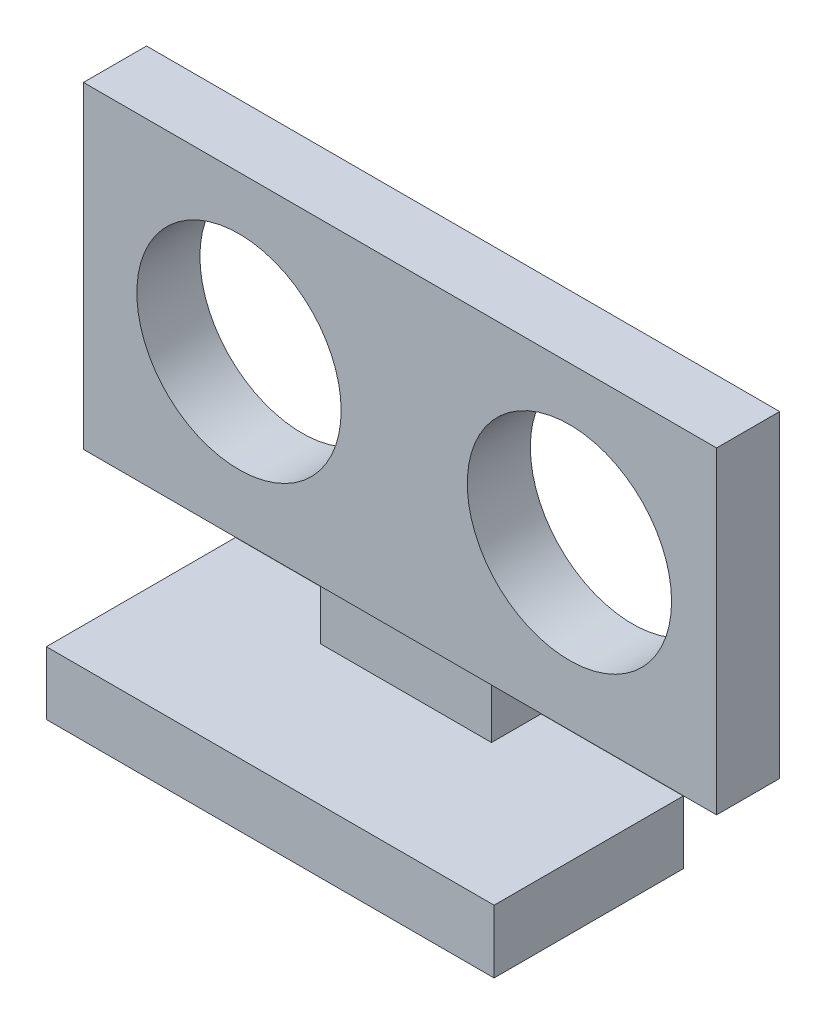
from build123d import *

# Parameters (mm, degrees)
SKETCH1_W           = 35.5
SKETCH1_H           = 15
BOSS_EXTRUDE7_DEPTH = 5
SKETCH5_W           = 13.567085075
SKETCH5_H           = 3.932792286
BOSS_EXTRUDE8_DEPTH = 5
SKETCH6_W           = 50.2
SKETCH6_H           = 5
BOSS_EXTRUDE9_DEPTH = 25.2
SKETCH7_R           = 8.1
CUT_EXTRUDE1_DEPTH  = 10


with BuildPart() as part:
    # Sketch1 → Boss-Extrude7 (new body)
    with BuildSketch(Plane(origin=(0, 0, 0), x_dir=(1, 0, 0), z_dir=(0, 1, 0))):
        with Locations((32.254129859, 13.775388257)):
            Rectangle(SKETCH1_W, SKETCH1_H)
    extrude(amount=BOSS_EXTRUDE7_DEPTH)

    # Sketch5 → Boss-Extrude8 (add)
    with BuildSketch(Plane(origin=(0, 5, 0), x_dir=(1, 0, 0), z_dir=(0, 1, 0))):
        with Locations((31.950040022, 19.308992114)):
            Rectangle(SKETCH5_W, SKETCH5_H)
    extrude(amount=BOSS_EXTRUDE8_DEPTH)

    # Sketch6 → Boss-Extrude9 (add)
    with BuildSketch(Plane(origin=(1.124638213, 10, 0), x_dir=(1, 0, 0), z_dir=(0, 1, 0))):
        with Locations((31.402213384, 18.794771585)):
            Rectangle(SKETCH6_W, SKETCH6_H)
    extrude(amount=BOSS_EXTRUDE9_DEPTH)

    # Sketch7 → Cut-Extrude1 (cut)
    with BuildSketch(Plane.XY.offset(-16.294771585)):
        with Locations((19.758900119, 22.875876323)):
            Circle(SKETCH7_R)
        with Locations((45.958900119, 22.875876323)):
            Circle(SKETCH7_R)
    extrude(amount=-CUT_EXTRUDE1_DEPTH, mode=Mode.SUBTRACT)


solid = part.part
